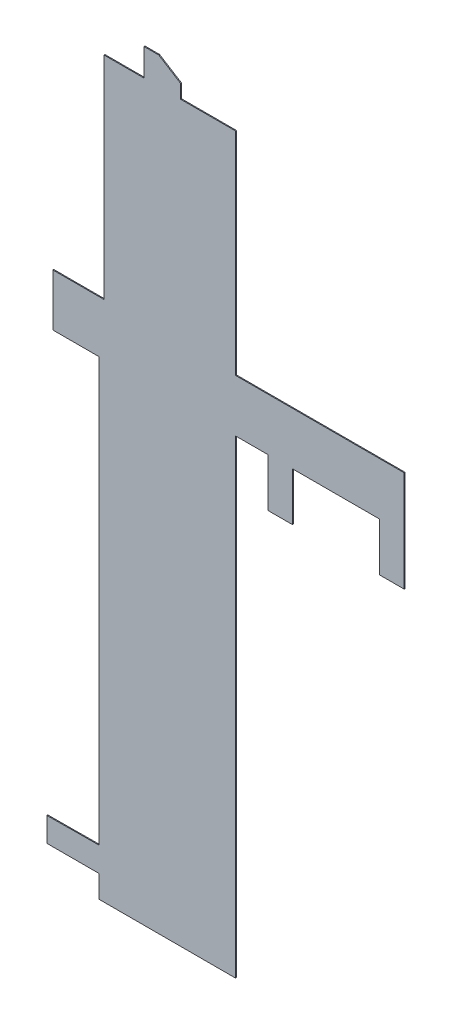
from build123d import *

# Parameters (mm, degrees)
SKETCH_1_W      = 16
SKETCH_1_H      = 30
SKETCH_1_W_2    = 27
SKETCH_1_H_2    = 53
SKETCH_1_W_3    = 60
SKETCH_1_H_3    = 55
SKETCH_1_H_4    = 57.5
SKETCH_1_H_5    = 117
SKETCH_1_H_6    = 117.5
SKETCH_1_W_4    = 125.5
SKETCH_1_H_7    = 60.4
SKETCH_1_H_8    = 230.9
EXTRUDE_1_DEPTH = 1
SKETCH_2_W      = 16
SKETCH_2_H      = 30
EXTRUDE_2_DEPTH = 10


with BuildPart() as part:
    # 草图1 → 拉伸1 (new body)
    with BuildSketch(Plane.XY.offset(42)):
        with Locations((450.5, -369.2)):
            Rectangle(SKETCH_1_W, SKETCH_1_H)
        Polygon((384.5, -354.2), (384.5, -384.2), (398.5, -384.2), (400.5, -384.2), (400.5, -354.2), align=None)
        with Locations((714, -700.1)):
            Rectangle(SKETCH_1_W_2, SKETCH_1_H_2)
        with Locations((591.5, -700.1)):
            Rectangle(SKETCH_1_W_2, SKETCH_1_H_2)
        Polygon((501.5, -423.1), (482.5, -423.1), (482.5, -443.7), (542.5, -443.7), (542.5, -413.6), (501.5, -413.6), align=None)
        Polygon((482.5, -410.1), (501.5, -410.1), (501.5, -413.6), (542.5, -413.6), (542.5, -384.2), (482.5, -384.2), align=None)
        with Locations((512.5, -471.2)):
            Rectangle(SKETCH_1_W_3, SKETCH_1_H_3)
        with Locations((428.5, -470.45)):
            Rectangle(SKETCH_1_W_3, SKETCH_1_H_4)
        Polygon((398.5, -384.2), (400.5, -384.2), (442.5, -384.2), (458.5, -384.2), (458.5, -441.7), (398.5, -441.7), align=None)
        with Locations((428.5, -557.7)):
            Rectangle(SKETCH_1_W_3, SKETCH_1_H_5)
        with Locations((512.5, -557.45)):
            Rectangle(SKETCH_1_W_3, SKETCH_1_H_6)
        with Locations((479.75, -1157.9)):
            Rectangle(SKETCH_1_W_4, SKETCH_1_H_7)
        Polygon((417, -896.8), (542.5, -896.8), (542.5, -786.2), (417.295919732, -786.2), align=None)
        Polygon((417.295919732, -786.2), (417.598084778, -673.265814274), (393, -673.2), (393, -1136.7), (336, -1137.1), (336, -1163.6), (393, -1163.6), (393, -1188.1), (417, -1188.1), (417, -1127.7), (417, -896.8), align=None)
        Polygon((542.5, -786.2), (542.5, -673.6), (417.598084778, -673.265814274), (417.295919732, -786.2), align=None)
        with Locations((479.75, -1012.25)):
            Rectangle(SKETCH_1_W_4, SKETCH_1_H_8)
        Polygon((393, -673.2), (342.5, -673.2), (342.5, -616.2), (398.5, -616.2), (458.5, -616.2), (458.5, -499.2), (458.5, -441.7), (458.5, -384.2), (458.5, -354.2), (482.5, -369.2), (482.5, -384.2), (482.5, -410.1), (501.5, -410.1), (501.5, -413.6), (501.5, -423.1), (482.5, -423.1), (482.5, -443.7), (482.5, -498.7), (482.5, -616.2), (542.5, -616.2), (727.5, -616.2), (727.5, -673.6), (700.5, -673.6), (605, -673.6), (578, -673.6), (542.5, -673.6), (417.598084778, -673.265814274), align=None)
    extrude(amount=-EXTRUDE_1_DEPTH)

    # 草图2 → 拉伸2 (cut)
    with BuildSketch(Plane.XY.offset(42)):
        with Locations((392.5, -369.2)):
            Rectangle(SKETCH_2_W, SKETCH_2_H)
    extrude(amount=-EXTRUDE_2_DEPTH, mode=Mode.SUBTRACT)


solid = part.part
